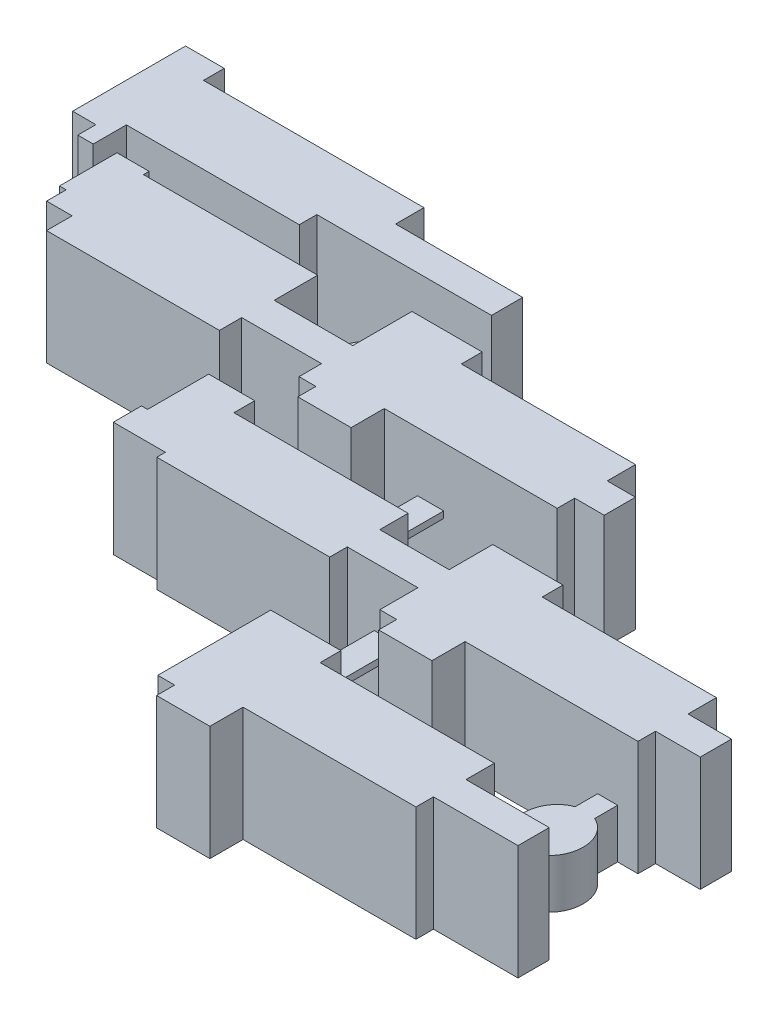
from build123d import *

# Parameters (mm, degrees)
EXTRUDE_1_DEPTH   = 35
EXTRUDE_1_2_DEPTH = 35
EXTRUDE_1_3_DEPTH = 35
EXTRUDE_1_4_DEPTH = 35
EXTRUDE_2_DEPTH   = 15
SKETCH_3_W        = 8
SKETCH_3_H        = 2
EXTRUDE_3_DEPTH   = 23
SKETCH_4_W        = 8
SKETCH_4_H        = 2
EXTRUDE_4_DEPTH   = 30
SKETCH_5_W        = 8
SKETCH_5_H        = 2
EXTRUDE_5_DEPTH   = 33


with BuildPart() as part:
    # 草图1 → 凸台-拉伸1 (new body)
    with BuildSketch(Plane(origin=(0, 0, 0), x_dir=(1, 0, 0), z_dir=(0, 1, 0))):
        Polygon((-50, 15), (-28.571428571, 15), (-28.571428571, 8.650793651), (24.603174603, 8.650793651), (24.603174603, 0), (50, 0), (50, -9.523809524), (24.206349206, -9.523809524), (24.206349206, -14.880952381), (-28.571428571, -14.880952381), (-28.571428571, -25), (-44.841269841, -25), (-44.841269841, -19.474869842), (-50, -19.474869842), align=None)
    extrude(amount=EXTRUDE_1_DEPTH)


with BuildPart() as body_2:
    # 草图1 → Extrude 1 2 (new body)
    with BuildSketch(Plane(origin=(0, 0, 0), x_dir=(1, 0, 0), z_dir=(0, 1, 0))):
        Polygon((-107.794400387, 61.56232169), (-54.619797212, 61.56232169), (-54.619797212, 52.91152804), (-33.447399942, 52.91152804), (-33.447399942, 66.231254849), (-12.018828513, 66.231254849), (-12.018828513, 59.8820485), (41.155774662, 59.8820485), (41.155774662, 51.231254849), (54.410686269, 51.231254849), (54.410686269, 41.707445325), (40.758949265, 41.707445325), (40.758949265, 36.350302468), (-12.018828513, 36.350302468), (-12.018828513, 26.231254849), (-28.288669783, 26.231254849), (-28.288669783, 31.756385007), (-33.447399942, 31.756385007), (-33.447399942, 43.387718516), (-55.016622609, 43.387718516), (-55.016622609, 38.030575659), (-107.794400387, 38.030575659), (-107.794400387, 40.648099537), (-123.6923492, 40.648099537), (-123.6923492, 49.25836902), (-121.845067006, 49.25836902), (-121.845067006, 67.91152804), (-107.794400387, 67.91152804), align=None)
    extrude(amount=EXTRUDE_1_2_DEPTH)



with BuildPart() as body_3:
    # 草图1 → Extrude 1 3 (new body)
    with BuildSketch(Plane(origin=(0, 0, 0), x_dir=(1, 0, 0), z_dir=(0, 1, 0))):
        Polygon((-184.539969284, 110.691667643), (-131.365366109, 110.691667643), (-131.365366109, 97.427275906), (-107.392513521, 97.427275906), (-107.392513521, 115.507776756), (-85.963942093, 115.507776756), (-85.963942093, 109.158570406), (-32.789338918, 109.158570406), (-32.789338918, 100.507776756), (-24.173934052, 100.507776756), (-24.173934052, 90.983967232), (-33.186164315, 90.983967232), (-33.186164315, 85.626824375), (-85.963942093, 85.626824375), (-85.963942093, 75.507776756), (-102.233783362, 75.507776756), (-102.233783362, 81.032906914), (-107.392513521, 81.032906914), (-107.392513521, 87.903466382), (-131.762191506, 87.903466382), (-131.762191506, 81.109403196), (-184.539969284, 81.109403196), (-184.539969284, 88.915387374), (-192.325966845, 88.915387374), (-192.325966845, 94.87339593), (-194.358266929, 94.87339593), (-194.358266929, 112.427275906), (-184.539969284, 112.427275906), align=None)
    extrude(amount=EXTRUDE_1_3_DEPTH)


with BuildPart() as body_4:
    # 草图1 → Extrude 1 4 (new body)
    with BuildSketch(Plane(origin=(0, 0, 0), x_dir=(1, 0, 0), z_dir=(0, 1, 0))):
        Polygon((-200.299569392, 144.7711918), (-133.000655414, 144.7711918), (-133.000655414, 136.120398149), (-94.213200191, 136.120398149), (-94.213200191, 126.596588625), (-147.521791614, 126.596588625), (-147.521791614, 121.239445768), (-200.299569392, 121.239445768), (-200.299569392, 111.120398149), (-205.014733331, 111.120398149), (-205.014733331, 116.645528307), (-212.116113646, 116.645528307), (-212.116113646, 151.120398149), (-200.299569392, 151.120398149), align=None)
    extrude(amount=EXTRUDE_1_4_DEPTH)


with BuildPart() as body_2_1:
    add(body_2.part)

    add(body_3.part)  # 凸台-拉伸2 merges body 3

    add(body_4.part)  # 凸台-拉伸2 merges body 4
    # 草图2 → 凸台-拉伸2 (add)
    with BuildSketch(Plane(origin=(0, 0, 0), x_dir=(1, 0, 0), z_dir=(0, 1, 0))):
        with BuildLine():
            Line((28.443898962, 29.487740992), (28.443898962, 41.999795529))
            Line((28.443898962, 41.999795529), (34.539192055, 40.886907122))
            Line((34.539192055, 40.886907122), (34.539192055, 29.317255347))
            add(Edge.make_bspline(
                [(34.539192055, 10.687190226), (56.564255054, 20.002222786), (34.539192055, 29.317255347)],
                knots=[0.367556342, 0.367556342, 0.367556342, 2.774036311, 2.774036311, 2.774036311], degree=2, weights=[1, 0.359336066, 1]))
            Line((34.539192055, 10.687190226), (34.539192055, 0.204653136))
            Line((34.539192055, 0.204653136), (28.443898962, 0.204653136))
            Line((28.443898962, 0.204653136), (28.443898962, 10.516704581))
            add(Edge.make_bspline(
                [(28.443898962, 29.487740992), (2.087181458, 20.002222786), (28.443898962, 10.516704581)],
                knots=[3.458229464, 3.458229464, 3.458229464, 5.966548497, 5.966548497, 5.966548497], degree=2, weights=[1, 0.311372329, 1]))
        make_face()
        with BuildLine():
            Line((-48.059265181, 77.472796895), (-48.059265181, 89.984851433))
            Line((-48.059265181, 89.984851433), (-41.963972088, 88.871963026))
            Line((-41.963972088, 88.871963026), (-41.963972088, 77.30231125))
            add(Edge.make_bspline(
                [(-41.963972088, 58.67224613), (-19.938909089, 67.98727869), (-41.963972088, 77.30231125)],
                knots=[0.367556342, 0.367556342, 0.367556342, 2.774036311, 2.774036311, 2.774036311], degree=2, weights=[1, 0.359336066, 1]))
            Line((-41.963972088, 58.67224613), (-41.963972088, 48.18970904))
            Line((-41.963972088, 48.18970904), (-48.059265181, 48.18970904))
            Line((-48.059265181, 48.18970904), (-48.059265181, 58.501760485))
            add(Edge.make_bspline(
                [(-48.059265181, 77.472796895), (-74.415982685, 67.98727869), (-48.059265181, 58.501760485)],
                knots=[3.458229464, 3.458229464, 3.458229464, 5.966548497, 5.966548497, 5.966548497], degree=2, weights=[1, 0.311372329, 1]))
        make_face()
        with BuildLine():
            Line((-123.025536653, 135.366292674), (-116.93024356, 134.253404267))
            Line((-116.93024356, 134.253404267), (-116.93024356, 122.683752491))
            add(Edge.make_bspline(
                [(-116.93024356, 104.053687371), (-94.905180561, 113.368719931), (-116.93024356, 122.683752491)],
                knots=[0.367556342, 0.367556342, 0.367556342, 2.774036311, 2.774036311, 2.774036311], degree=2, weights=[1, 0.359336066, 1]))
            Line((-116.93024356, 104.053687371), (-116.93024356, 93.571150281))
            Line((-116.93024356, 93.571150281), (-123.025536653, 93.571150281))
            Line((-123.025536653, 93.571150281), (-123.025536653, 103.883201726))
            add(Edge.make_bspline(
                [(-123.025536653, 122.854238137), (-149.382254157, 113.368719931), (-123.025536653, 103.883201726)],
                knots=[3.458229464, 3.458229464, 3.458229464, 5.966548497, 5.966548497, 5.966548497], degree=2, weights=[1, 0.311372329, 1]))
            Line((-123.025536653, 122.854238137), (-123.025536653, 135.366292674))
        make_face()
    extrude(amount=EXTRUDE_2_DEPTH)

    # 草图3 → 凸台-拉伸3 (add)
    with BuildSketch(Plane.XY.offset(-121.239445768)):
        with Locations((-163.976955411, 16)):
            Rectangle(SKETCH_3_W, SKETCH_3_H)
    extrude(amount=EXTRUDE_3_DEPTH)

    # 草图4 → 凸台-拉伸4 (add)
    with BuildSketch(Plane.XY.offset(-87.903466382)):
        with Locations((-71.817837358, 16)):
            Rectangle(SKETCH_4_W, SKETCH_4_H)
    extrude(amount=EXTRUDE_4_DEPTH)

    # 草图5 → 凸台-拉伸5 (add)
    with BuildSketch(Plane.XY.offset(-43.387718516)):
        with Locations((-42.779110495, 16)):
            Rectangle(SKETCH_5_W, SKETCH_5_H)
    extrude(amount=EXTRUDE_5_DEPTH)


solid = Compound([part.part, body_2_1.part])
